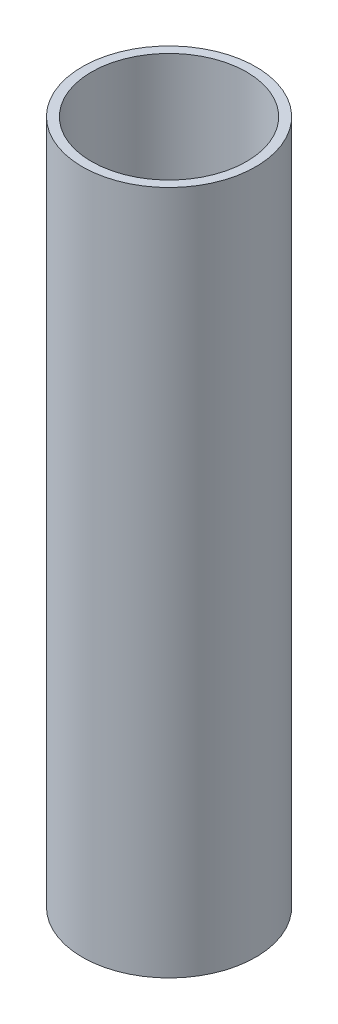
from build123d import *

# Parameters (mm, degrees)
SKETCH_1_W = 4
SKETCH_1_H = 300


with BuildPart() as part:
    # Эскиз1 → Повернуть-Тонкостенный1 (revolve)
    with BuildSketch(Plane.XY):
        with Locations((-36, 150)):
            Rectangle(SKETCH_1_W, SKETCH_1_H)
    revolve(axis=Axis((0, 26.168985987, 0), (0, -1, 0)))


solid = part.part
